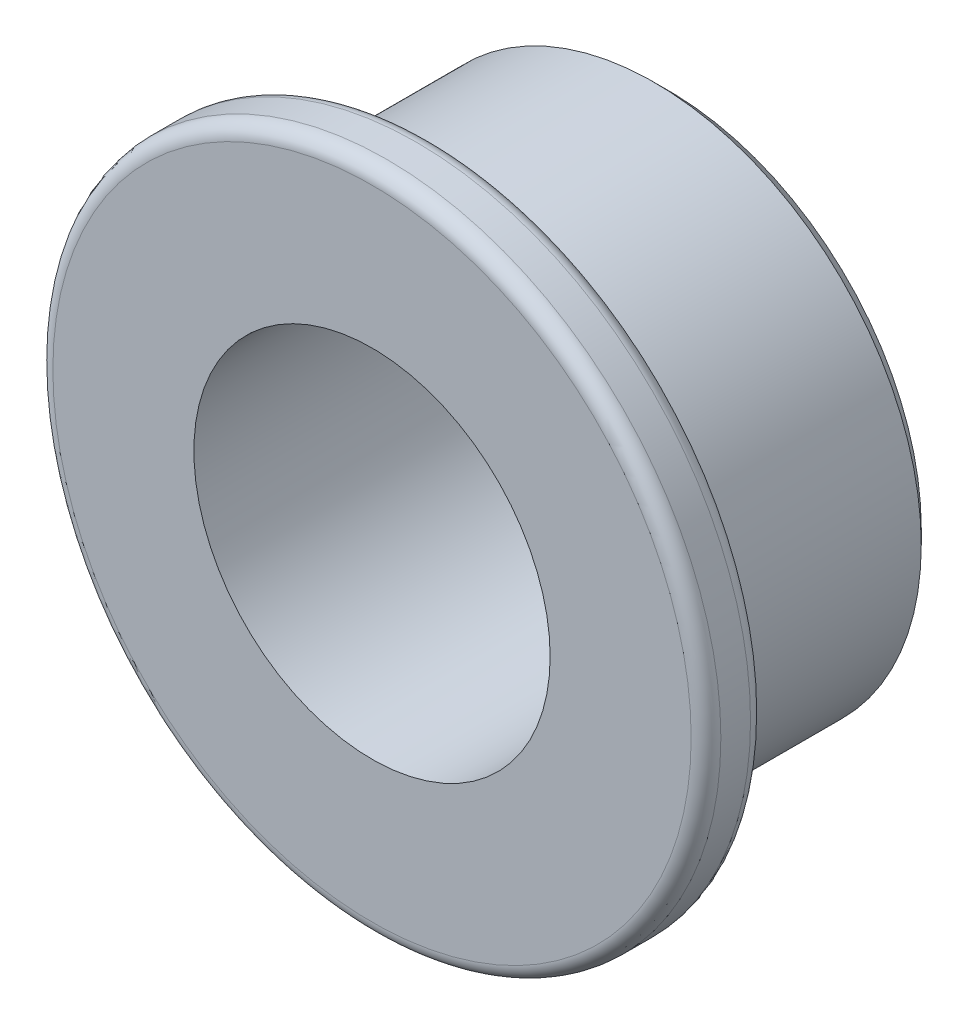
from build123d import *

# Parameters (mm, degrees)
SKETCH1_R           = 9
SKETCH1_R_2         = 6
BOSS_EXTRUDE1_DEPTH = 8
BOSS_EXTRUDE2_START = 2
SKETCH2_R           = 11.25
SKETCH2_R_2         = 6
BOSS_EXTRUDE2_DEPTH = 2
FILLET1_R           = 0.5
FILLET2_R           = 0.5
FILLET3_R           = 0.8
CHAMFER1_SIZE       = 0.5


with BuildPart() as part:
    # Sketch1 → Boss-Extrude1 (new body)
    with BuildSketch(Plane.XY):
        Circle(SKETCH1_R)
        Circle(SKETCH1_R_2, mode=Mode.SUBTRACT)
    extrude(amount=-BOSS_EXTRUDE1_DEPTH)

    # Sketch2 → Boss-Extrude2 (add)
    with BuildSketch(Plane.XY.offset(BOSS_EXTRUDE2_START)):
        Circle(SKETCH2_R)
        Circle(SKETCH2_R_2, mode=Mode.SUBTRACT)
    extrude(amount=-BOSS_EXTRUDE2_DEPTH)

    # Fillet1
    fillet1_edges = [part.edges().sort_by_distance(p)[0] for p in [
        (-11.25, 0, 2),
    ]]
    fillet(fillet1_edges, radius=FILLET1_R)

    # Fillet2
    fillet2_edges = [part.edges().sort_by_distance(p)[0] for p in [
        (-11.25, 0, 0),
    ]]
    fillet(fillet2_edges, radius=FILLET2_R)

    # Fillet3
    fillet3_edges = [part.edges().sort_by_distance(p)[0] for p in [
        (-9, 0, 0),
    ]]
    fillet(fillet3_edges, radius=FILLET3_R)

    # Chamfer1
    chamfer1_edges = [part.edges().sort_by_distance(p)[0] for p in [
        (-9, 0, -8),
    ]]
    chamfer(chamfer1_edges, length=CHAMFER1_SIZE)


solid = part.part
